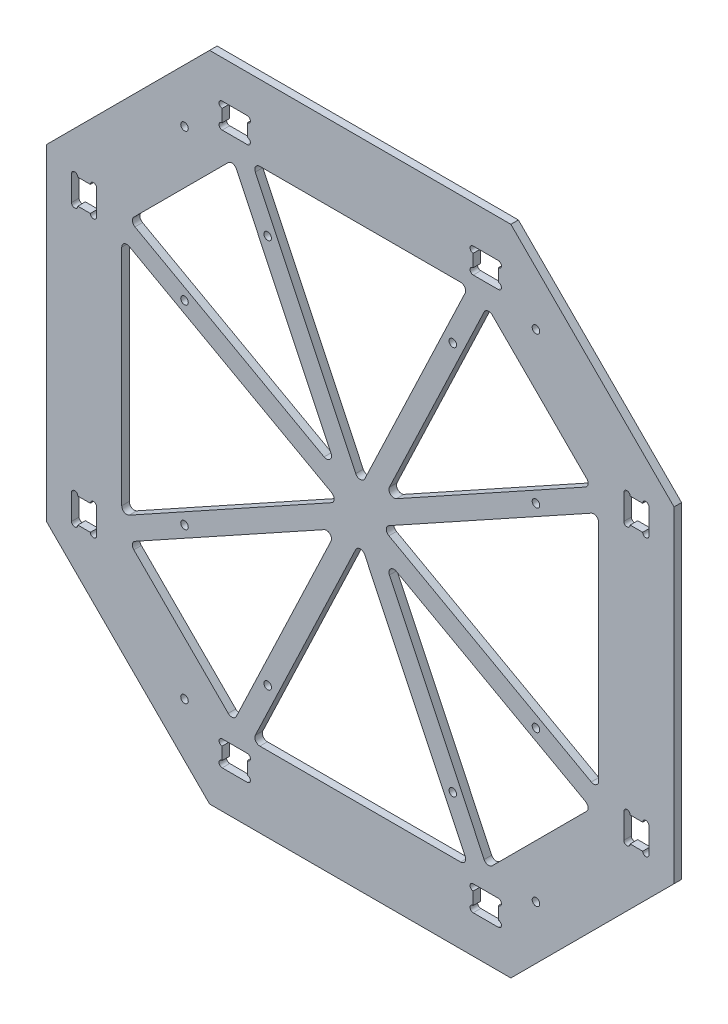
from build123d import *

# Parameters (mm, degrees)
SKETCH_1_W          = 250
SKETCH_1_H          = 260
EXTRUDE_1_DEPTH     = 1.5
SKETCH_2_W          = 10
SKETCH_2_H          = 10
CUT_EXTRUDE_1_DEPTH = 5
SKETCH_3_R          = 1.25
CUT_EXTRUDE_2_DEPTH = 5
SKETCH_4_R          = 1.25
CUT_EXTRUDE_3_DEPTH = 5
CUT_EXTRUDE_4_DEPTH = 5
CUT_EXTRUDE_5_DEPTH = 5
EXTRUDE_2_DEPTH     = 3
SKETCH_9_R          = 1.5
CUT_EXTRUDE_7_DEPTH = 10
FILLET_1_R          = 2
SKETCH_10_R         = 1.5
CUT_EXTRUDE_8_DEPTH = 10


with BuildPart() as part:
    # 草图1 → 凸台-拉伸1 (new, symmetric)
    with BuildSketch(Plane.XY):
        Rectangle(SKETCH_1_W, SKETCH_1_H)
    extrude(amount=EXTRUDE_1_DEPTH, both=True)

    # 草图2 → 切除-拉伸1 (cut, symmetric)
    with BuildSketch(Plane(origin=(0, 0, -1.5), x_dir=(-1, 0, 0), z_dir=(0, 0, -1))):
        with Locations((50, -110)):
            Rectangle(SKETCH_2_W, SKETCH_2_H)
        with Locations((-50, 110)):
            Rectangle(SKETCH_2_W, SKETCH_2_H)
        with Locations((50, 110)):
            Rectangle(SKETCH_2_W, SKETCH_2_H)
        with Locations((110, 55)):
            Rectangle(SKETCH_2_W, SKETCH_2_H)
        with Locations((110, -55)):
            Rectangle(SKETCH_2_W, SKETCH_2_H)
        with Locations((-50, -110)):
            Rectangle(SKETCH_2_W, SKETCH_2_H)
        with Locations((-110, 55)):
            Rectangle(SKETCH_2_W, SKETCH_2_H)
        with Locations((-110, -55)):
            Rectangle(SKETCH_2_W, SKETCH_2_H)
    extrude(amount=CUT_EXTRUDE_1_DEPTH, both=True, mode=Mode.SUBTRACT)

    # 草图3 → 切除-拉伸2 (cut, symmetric)
    with BuildSketch(Plane(origin=(0, 0, -1.5), x_dir=(-1, 0, 0), z_dir=(0, 0, -1))):
        with Locations((-55, 113.75)):
            Circle(SKETCH_3_R)
        with Locations((-55, 106.25)):
            Circle(SKETCH_3_R)
        with Locations((-45, 106.25)):
            Circle(SKETCH_3_R)
        with Locations((-45, 113.75)):
            Circle(SKETCH_3_R)
        with Locations((45, 113.75)):
            Circle(SKETCH_3_R)
        with Locations((45, 106.25)):
            Circle(SKETCH_3_R)
        with Locations((55, 106.25)):
            Circle(SKETCH_3_R)
        with Locations((55, 113.75)):
            Circle(SKETCH_3_R)
    cut_extrude_2 = extrude(amount=CUT_EXTRUDE_2_DEPTH, both=True, mode=Mode.SUBTRACT)

    # 草图4 → 切除-拉伸3 (cut, symmetric)
    with BuildSketch(Plane(origin=(0, 0, -1.5), x_dir=(-1, 0, 0), z_dir=(0, 0, -1))):
        with Locations((106.25, 60)):
            Circle(SKETCH_4_R)
        with Locations((113.75, 60)):
            Circle(SKETCH_4_R)
        with Locations((106.25, 50)):
            Circle(SKETCH_4_R)
        with Locations((113.75, 50)):
            Circle(SKETCH_4_R)
        with Locations((113.75, -50)):
            Circle(SKETCH_4_R)
        with Locations((106.25, -50)):
            Circle(SKETCH_4_R)
        with Locations((113.75, -60)):
            Circle(SKETCH_4_R)
        with Locations((106.25, -60)):
            Circle(SKETCH_4_R)
    cut_extrude_3 = extrude(amount=CUT_EXTRUDE_3_DEPTH, both=True, mode=Mode.SUBTRACT)

    # 镜向1: 切除-拉伸3 across plane
    add(cut_extrude_3.mirror(Plane(origin=(0, 0, 0), x_dir=(0, 0, 1), z_dir=(1, 0, 0))), mode=Mode.SUBTRACT)

    # 镜向2: 切除-拉伸2 across plane
    add(cut_extrude_2.mirror(Plane.ZX), mode=Mode.SUBTRACT)

    # 草图5 → 切除-拉伸4 (cut, symmetric)
    with BuildSketch(Plane(origin=(0, 0, -1.5), x_dir=(-1, 0, 0), z_dir=(0, 0, -1))):
        Polygon((-60, 130), (-125, 65), (-125, 130), align=None)
        Polygon((-125, -130), (-60, -130), (-125, -65), align=None)
    cut_extrude_4 = extrude(amount=CUT_EXTRUDE_4_DEPTH, both=True, mode=Mode.SUBTRACT)

    # 镜向3: 切除-拉伸4 across plane
    add(cut_extrude_4.mirror(Plane(origin=(0, 0, 0), x_dir=(0, 0, 1), z_dir=(1, 0, 0))), mode=Mode.SUBTRACT)

    # 草图6 → 切除-拉伸5 (cut, symmetric)
    with BuildSketch(Plane(origin=(0, 0, -1.5), x_dir=(-1, 0, 0), z_dir=(0, 0, -1))):
        Polygon((95, -52.573593129), (95, 52.573593129), (47.573593129, 100), (-47.573593129, 100), (-95, 52.573593129), (-95, -52.573593129), (-47.573593129, -100), (47.573593129, -100), align=None)
    extrude(amount=CUT_EXTRUDE_5_DEPTH, both=True, mode=Mode.SUBTRACT)

    # 草图7 → 凸台-拉伸2 (add)
    with BuildSketch(Plane(origin=(0, 0, -1.5), x_dir=(-1, 0, 0), z_dir=(0, 0, -1))):
        Polygon((-51.185672274, 98.281604164), (-8.964661116, 9.532766034), (-93.063178997, 56.073410896), (-96.936821003, 49.073775362), (-8.260959569, 0), (-96.936821003, -49.073775362), (-93.063178997, -56.073410896), (-8.964661116, -9.532766034), (-51.185672274, -98.281604164), (-43.961513984, -101.718395836), (0, -9.311009527), (43.961513984, -101.718395836), (51.185672274, -98.281604164), (8.964661116, -9.532766034), (93.063178997, -56.073410896), (96.936821003, -49.073775362), (8.260959569, 0), (96.936821003, 49.073775362), (93.063178997, 56.073410896), (8.964661116, 9.532766034), (51.185672274, 98.281604164), (43.961513984, 101.718395836), (0, 9.311009527), (-43.961513984, 101.718395836), align=None)
    extrude(amount=-EXTRUDE_2_DEPTH)

    # 草图9 → 切除-拉伸7 (cut)
    with BuildSketch(Plane(origin=(0, 0, -1.5), x_dir=(-1, 0, 0), z_dir=(0, 0, -1))):
        with Locations((70, 38.738437042)):
            Circle(SKETCH_9_R)
        with Locations((70, 98.738437042)):
            Circle(SKETCH_9_R)
        with Locations((70, -98.738437042)):
            Circle(SKETCH_9_R)
        with Locations((70, -38.738437042)):
            Circle(SKETCH_9_R)
    cut_extrude_7 = extrude(amount=-CUT_EXTRUDE_7_DEPTH, mode=Mode.SUBTRACT)

    # 镜向4: 切除-拉伸7 across plane
    add(cut_extrude_7.mirror(Plane(origin=(0, 0, 0), x_dir=(0, 0, 1), z_dir=(1, 0, 0))), mode=Mode.SUBTRACT)

    # 圆角1
    fillet_1_edges = [part.edges().sort_by_distance(p)[0] for p in [
        (-95, -48.001926526, 0),
        (-95, 48.001926526, 0),
        (-92.057005132, 55.516587997, 0),
        (-50.575201814, 96.998391315, 0),
        (-43.14401134, 100, 0),
        (43.14401134, 100, 0),
        (50.575201814, 96.998391315, 0),
        (92.057005132, 55.516587997, 0),
        (95, 48.001926526, 0),
        (95, -48.001926526, 0),
        (92.057005132, -55.516587997, 0),
        (50.575201814, -96.998391315, 0),
        (43.14401134, -100, 0),
        (-43.14401134, -100, 0),
        (-50.575201814, -96.998391315, 0),
        (-92.057005132, -55.516587997, 0),
        (-8.964661116, -9.532766034, 0),
        (0, -9.311009527, 0),
        (8.964661116, -9.532766034, 0),
        (8.260959569, 0, 0),
        (8.964661116, 9.532766034, 0),
        (0, 9.311009527, 0),
        (-8.964661116, 9.532766034, 0),
        (-8.260959569, 0, 0),
    ]]
    fillet(fillet_1_edges, radius=FILLET_1_R)

    # 草图10 → 切除-拉伸8 (cut)
    with BuildSketch(Plane(origin=(0, 0, -1.5), x_dir=(-1, 0, 0), z_dir=(0, 0, -1))):
        with Locations((36.869534675, 77.5)):
            Circle(SKETCH_10_R)
        with Locations((-36.869534675, 77.5)):
            Circle(SKETCH_10_R)
        with Locations((-36.869534675, -77.5)):
            Circle(SKETCH_10_R)
        with Locations((36.869534675, -77.5)):
            Circle(SKETCH_10_R)
    extrude(amount=-CUT_EXTRUDE_8_DEPTH, mode=Mode.SUBTRACT)


solid = part.part
